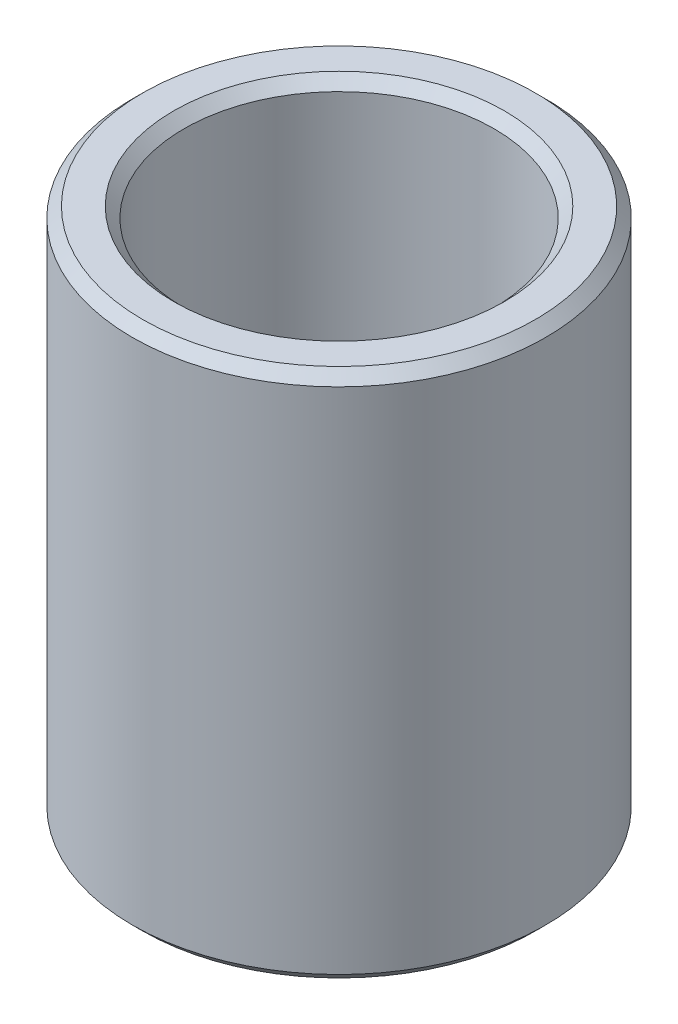
from build123d import *

# Parameters (mm, degrees)
SKIZZE1_R                       = 4
SKIZZE1_R_2                     = 3
AUFSATZ_LINEAR_AUSTRAGEN1_DEPTH = 10.25
FASE1_SIZE                      = 0.2


with BuildPart() as part:
    # Skizze1 → Aufsatz-Linear austragen1 (new body)
    with BuildSketch(Plane(origin=(0, 0, 0), x_dir=(1, 0, 0), z_dir=(0, 1, 0))):
        with Locations(Location((0, 0, 0), (0, 0, 270))):
            Circle(SKIZZE1_R)
        with Locations(Location((0, 0, 0), (0, 0, 270))):
            Circle(SKIZZE1_R_2, mode=Mode.SUBTRACT)
    extrude(amount=AUFSATZ_LINEAR_AUSTRAGEN1_DEPTH)

    # Fase1
    fase1_edges = [part.edges().sort_by_distance(p)[0] for p in [
        (0, 0, -4),
        (0, 10.25, -4),
        (0, 0, -3),
        (0, 10.25, -3),
    ]]
    chamfer(fase1_edges, length=FASE1_SIZE)


solid = part.part
